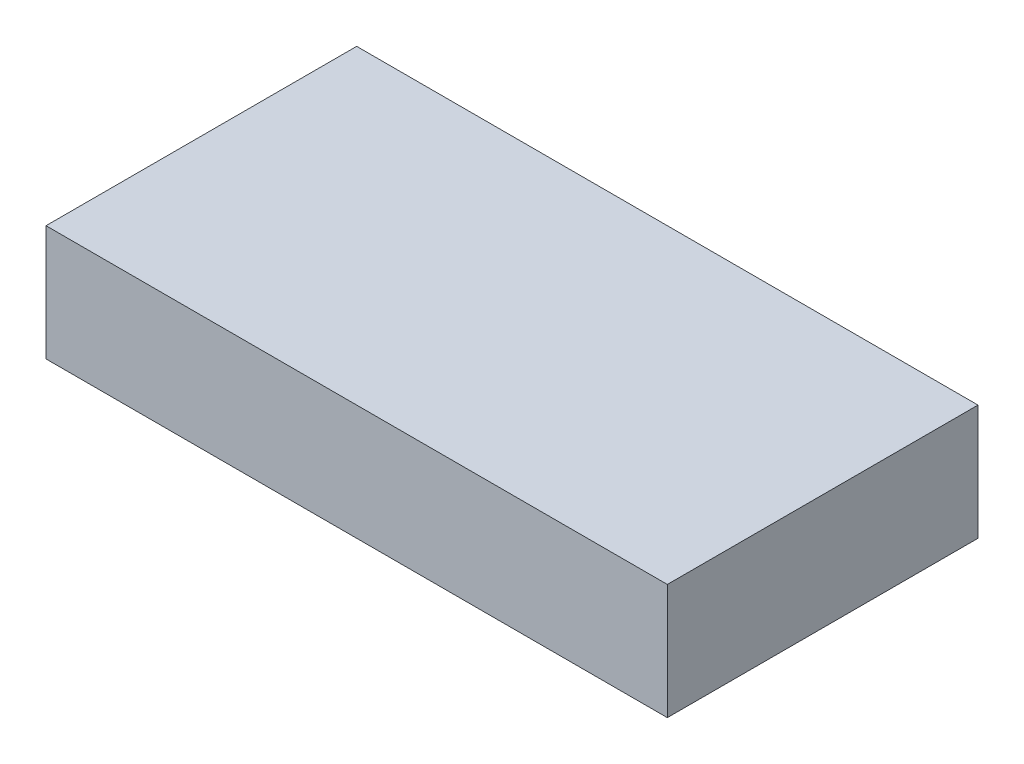
from build123d import *

# Parameters (mm, degrees)
SKETCH1_W           = 70
SKETCH1_H           = 35
BOSS_EXTRUDE1_DEPTH = 13


with BuildPart() as part:
    # Sketch1 → Boss-Extrude1 (new body)
    with BuildSketch(Plane(origin=(0, 0, 0), x_dir=(1, 0, 0), z_dir=(0, 1, 0))):
        with Locations((-35, -17.5)):
            Rectangle(SKETCH1_W, SKETCH1_H)
    extrude(amount=BOSS_EXTRUDE1_DEPTH)


solid = part.part
